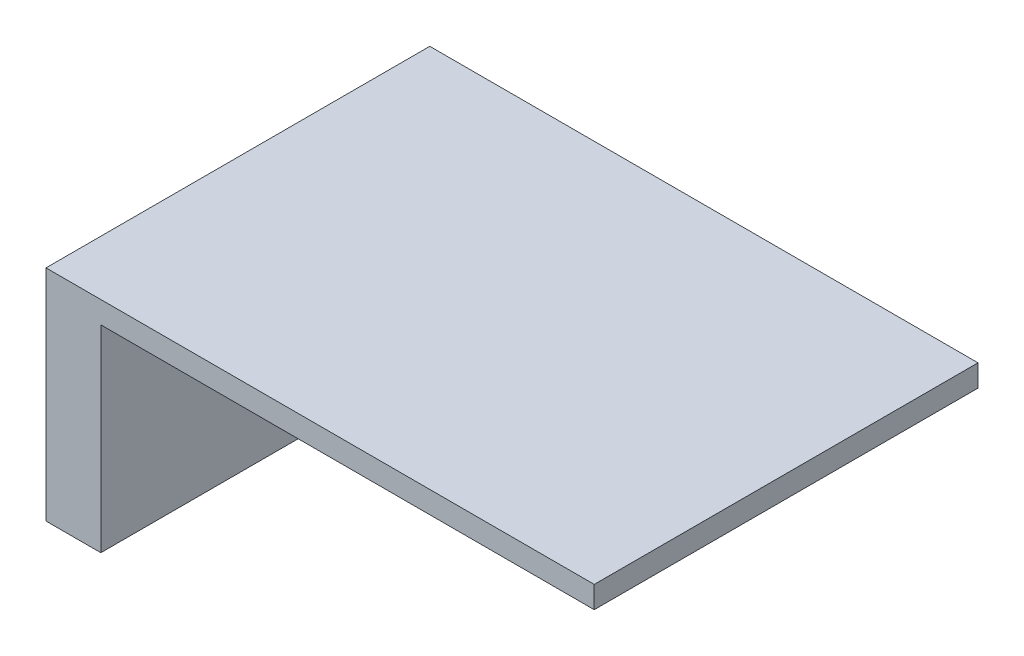
from build123d import *

# Parameters (mm, degrees)
BOSS_EXTRUDE1_DEPTH = 17.5


with BuildPart() as part:
    # Sketch1 → Boss-Extrude1 (new body)
    with BuildSketch(Plane.XY):
        Polygon((0, 0), (0, 10), (25, 10), (25, 9), (2.5, 9), (2.5, 0), align=None)
    extrude(amount=BOSS_EXTRUDE1_DEPTH)


solid = part.part
